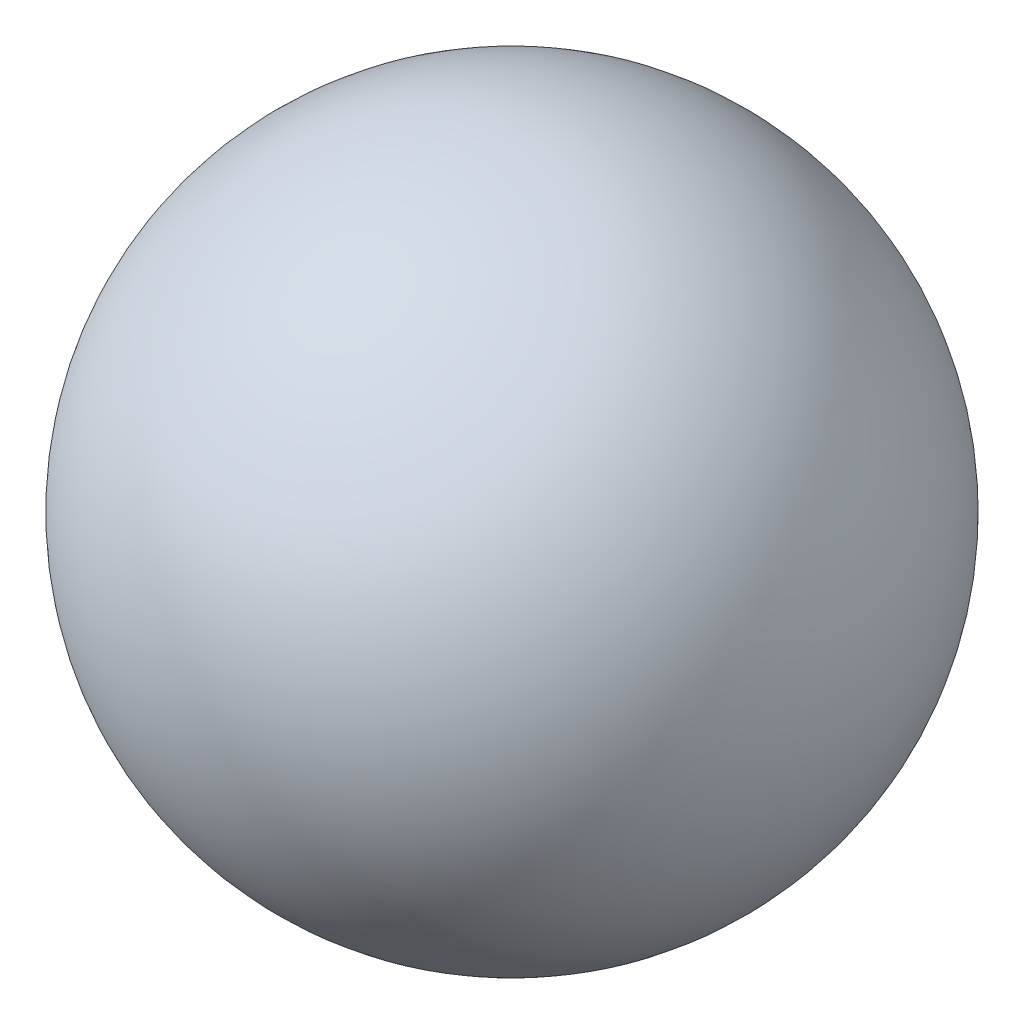
from build123d import *


with BuildPart() as part:
    # Sketch1 → Revolve1 (revolve)
    with BuildSketch(Plane.XY):
        with BuildLine():
            Line((0, 25.4), (0, 0))
            ThreePointArc((0, 0), (12.7, 12.7), (0, 25.4))
        make_face()
    revolve(axis=Axis((0, 0, 0), (0, 1, 0)))


solid = part.part
